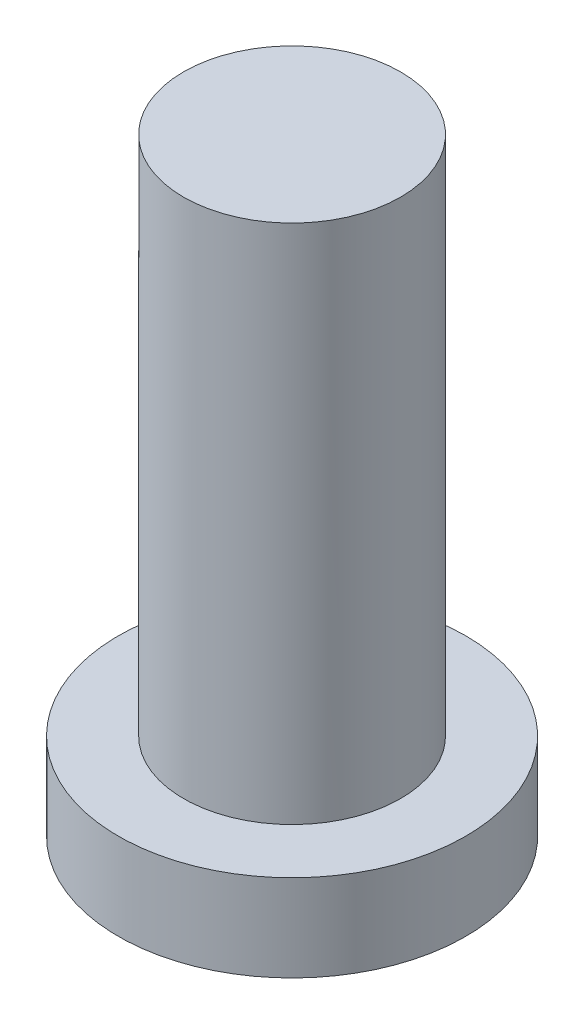
from build123d import *

# Parameters (mm, degrees)
SKETCH1_R           = 1.25
BOSS_EXTRUDE1_DEPTH = 6
SKETCH2_R           = 2
BOSS_EXTRUDE2_DEPTH = 1


with BuildPart() as part:
    # Sketch1 → Boss-Extrude1 (new body)
    with BuildSketch(Plane(origin=(0, 0, 0), x_dir=(1, 0, 0), z_dir=(0, 1, 0))):
        with Locations(Location((0, 0, 0), (0, 0, 270))):
            Circle(SKETCH1_R)
    extrude(amount=BOSS_EXTRUDE1_DEPTH)

    # Sketch2 → Boss-Extrude2 (add)
    with BuildSketch(Plane.XZ):
        with Locations(Location((0, 0, 0), (0, 0, 270))):
            Circle(SKETCH2_R)
    extrude(amount=BOSS_EXTRUDE2_DEPTH)


solid = part.part
